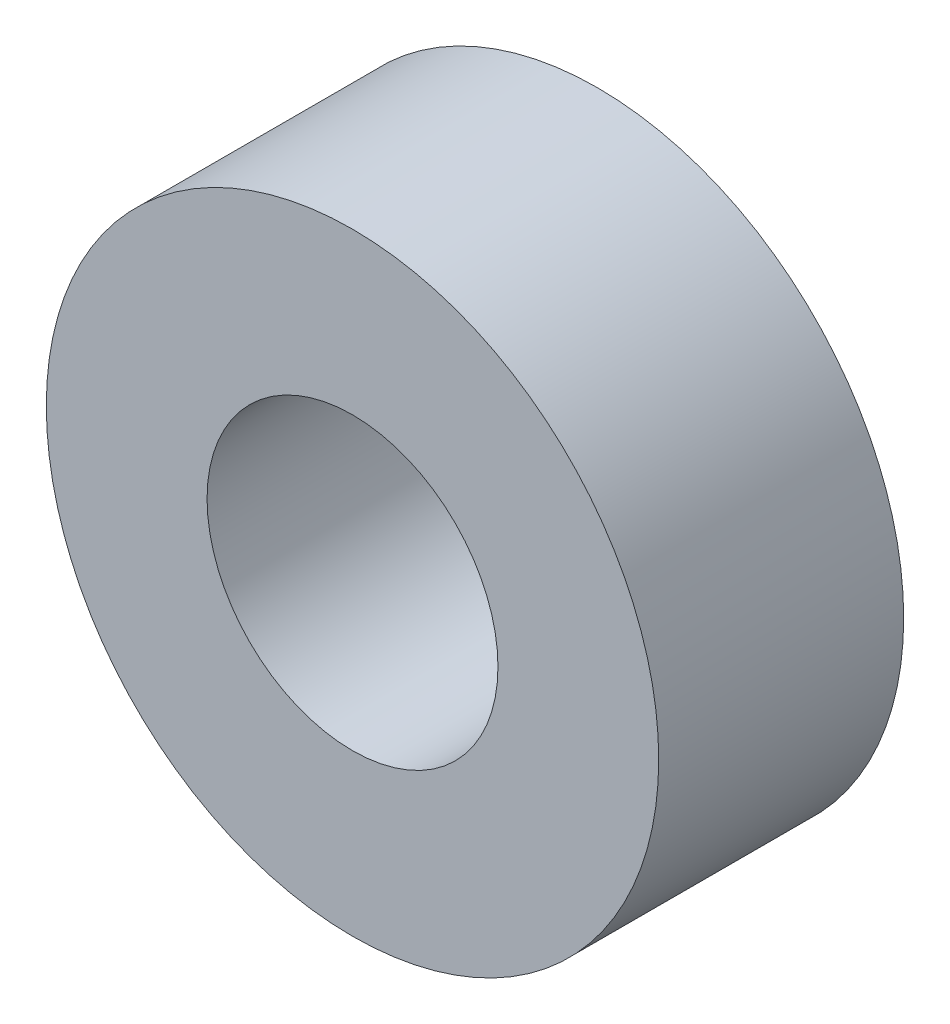
from build123d import *

# Parameters (mm, degrees)
SKETCH1_R           = 10
SKETCH1_R_2         = 4.75
BOSS_EXTRUDE1_DEPTH = 8


with BuildPart() as part:
    # Sketch1 → Boss-Extrude1 (new body)
    with BuildSketch(Plane.XY):
        Circle(SKETCH1_R)
        Circle(SKETCH1_R_2, mode=Mode.SUBTRACT)
    extrude(amount=BOSS_EXTRUDE1_DEPTH)


solid = part.part
